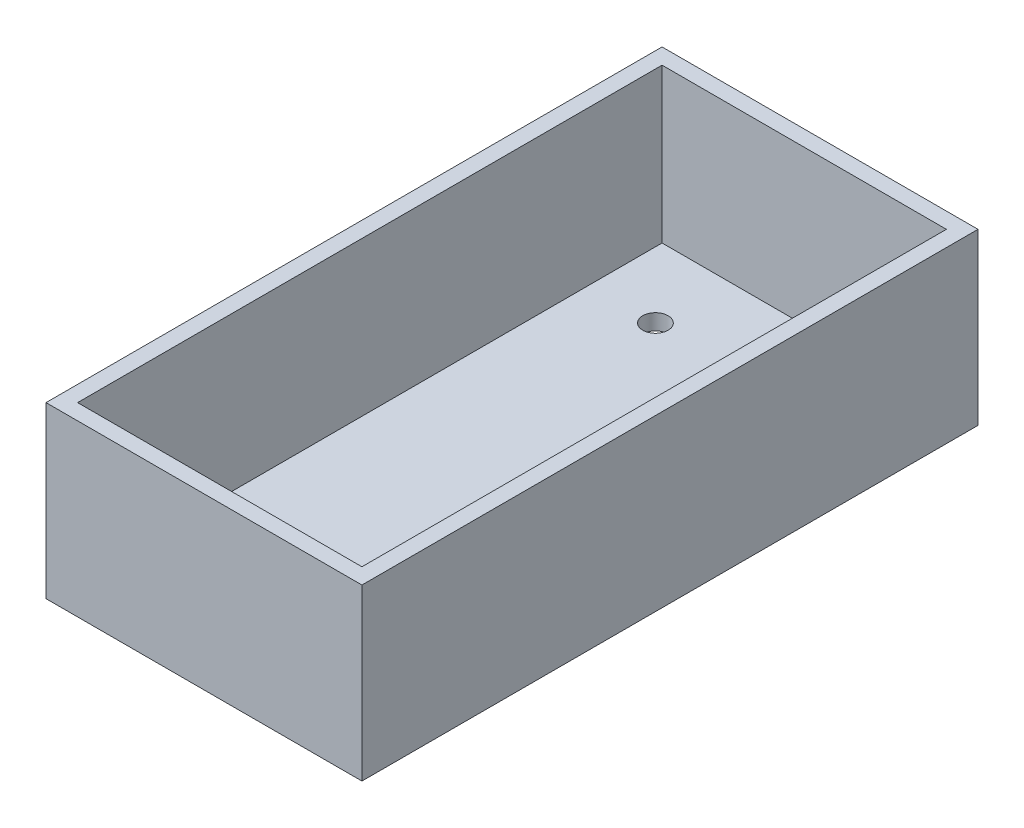
from build123d import *

# Parameters (mm, degrees)
SKETCH_1_W          = 40
SKETCH_1_H          = 78
EXTRUDE_1_DEPTH     = 21.5
SHELL_1_T           = -2
SKETCH_2_R          = 1.6
CUT_EXTRUDE_1_DEPTH = 40


with BuildPart() as part:
    # Эскиз1 → Бобышка-Вытянуть1 (new body)
    with BuildSketch(Plane(origin=(0, 0, 0), x_dir=(1, 0, 0), z_dir=(0, 1, 0))):
        with Locations((20, 39)):
            Rectangle(SKETCH_1_W, SKETCH_1_H)
    extrude(amount=EXTRUDE_1_DEPTH)

    # Оболочка1
    shell_1_openings = [part.faces().sort_by_distance(p)[0] for p in [
        (20, 21.5, -39),
    ]]
    offset(amount=SHELL_1_T, openings=shell_1_openings, kind=Kind.INTERSECTION)

    # Эскиз2 → Вырез-Вытянуть1 (cut)
    with BuildSketch(Plane(origin=(0, 21.5, 0), x_dir=(1, 0, 0), z_dir=(0, 1, 0))):
        with Locations(Location((10.35, 66.81, 0), (0, 0, 90))):
            Circle(SKETCH_2_R)
        with Locations(Location((29.65, 66.81, 0), (0, 0, 90))):
            Circle(SKETCH_2_R)
        with Locations(Location((29.65, 11.19, 0), (0, 0, 90))):
            Circle(SKETCH_2_R)
        with Locations(Location((10.35, 11.19, 0), (0, 0, 90))):
            Circle(SKETCH_2_R)
    extrude(amount=-CUT_EXTRUDE_1_DEPTH, mode=Mode.SUBTRACT)


solid = part.part
